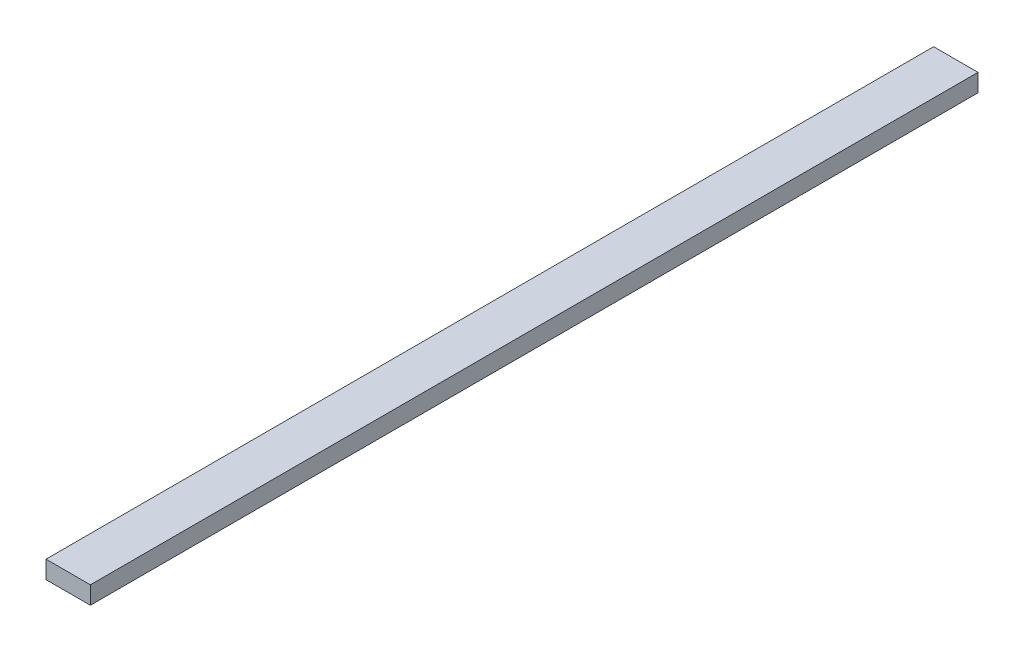
from build123d import *

# Parameters (mm, degrees)
CROQUIS1_R                   = 2.5
SALIENTE_EXTRUIR1_DEPTH      = 1.25
SALIENTE_EXTRUIR4_DEPTH      = 2.5
CROQUIS6_R                   = 12.525
CORTAR_EXTRUIR3_DEPTH        = 10
SALIENTE_EXTRUIR5_DEPTH      = 200
CROQUIS8_R                   = 12.525
SALIENTE_EXTRUIR6_DEPTH      = 21
CROQUIS10_W                  = 18.5
CROQUIS10_H                  = 25.138120499
CROQUIS10_W_2                = 2.5
CROQUIS10_H_2                = 4.861879501
CROQUIS10_H_3                = 5
CORTAR_EXTRUIR5_DEPTH        = 98
SALIENTE_EXTRUIR7_DEPTH      = 50
SALIENTE_EXTRUIR8_DEPTH      = 15
SALIENTE_EXTRUIR8_DEPTH_BACK = 265
CROQUIS15_W                  = 250
CROQUIS15_H                  = 5
CROQUIS15_W_2                = 280
SALIENTE_EXTRUIR9_DEPTH      = 7.5
CROQUIS16_W                  = 280
CROQUIS16_H                  = 5
CROQUIS16_W_2                = 250
CROQUIS16_H_2                = 30.3
CORTAR_EXTRUIR6_DEPTH        = 86


with BuildPart() as part:
    # Croquis1 → Saliente-Extruir1 (new, symmetric)
    with BuildSketch(Plane(origin=(0, 0, 0), x_dir=(0, 0, -1), z_dir=(1, 0, 0))):
        with BuildLine():
            Line((125, -2.5), (-125, -2.5))
            Line((-125, -2.5), (-125, 2.5))
            Line((-125, 2.5), (-123, 2.5))
            Line((-123, 2.5), (-117, 17.5))
            ThreePointArc((-117, 17.5), (-110, 24.5), (-103, 17.5))
            Line((-103, 17.5), (-97, 2.5))
            Line((-97, 2.5), (125, 2.5))
            Line((125, 2.5), (125, -2.5))
        make_face()
        with Locations((-110, 17.5)):
            Circle(CROQUIS1_R, mode=Mode.SUBTRACT)
    extrude(amount=SALIENTE_EXTRUIR1_DEPTH, both=True)

    # Croquis5 → Saliente-Extruir4 (add, through all)
    with BuildSketch(Plane(origin=(1.25, 0, 0), x_dir=(0, 0, -1), z_dir=(1, 0, 0))):
        with BuildLine():
            ThreePointArc((-100, 10), (-110, 5), (-120, 10))
            Line((-120, 10), (-121.0552482, 7.361879501))
            ThreePointArc((-121.0552482, 7.361879501), (-110, 2.5), (-98.9447518, 7.361879501))
            Line((-98.9447518, 7.361879501), (-100, 10))
        make_face()
        with BuildLine():
            Line((-121.0552482, 7.361879501), (-120, 10))
            ThreePointArc((-120, 10), (-113.952847075, 29.358541226), (-97.5, 17.5))
            ThreePointArc((-97.5, 17.5), (-98.141458774, 13.547152925), (-100, 10))
            Line((-100, 10), (-98.9447518, 7.361879501))
            ThreePointArc((-98.9447518, 7.361879501), (-96.020931308, 12.060731804), (-95, 17.5))
            ThreePointArc((-95, 17.5), (-115.439268196, 31.479068692), (-121.0552482, 7.361879501))
        make_face()
    extrude(amount=-SALIENTE_EXTRUIR4_DEPTH)

    # Croquis6 → Cortar-Extruir3 (cut)
    with BuildSketch(Plane(origin=(1.25, 0, 0), x_dir=(0, 0, -1), z_dir=(1, 0, 0))):
        with Locations((-110, 17.5)):
            Circle(CROQUIS6_R)
    extrude(amount=-CORTAR_EXTRUIR3_DEPTH, mode=Mode.SUBTRACT)

    # Croquis7 → Saliente-Extruir5 (add)
    with BuildSketch(Plane(origin=(0, 0, -125), x_dir=(-1, 0, 0), z_dir=(0, 0, -1))):
        Polygon((3.75, 37.8), (3.75, -2.5), (1.25, -2.5), (1.25, 2.5), (1.25, 32.8), (-1.25, 32.8), (-1.25, 37.8), align=None)
    extrude(amount=-SALIENTE_EXTRUIR5_DEPTH)

    # Croquis8 → Saliente-Extruir6 (add)
    with BuildSketch(Plane.ZY.offset(1.25)):
        with BuildLine():
            Line((98.9447518, 7.361879501), (97, 2.5))
            Line((97, 2.5), (95, 2.5))
            Line((95, 2.5), (95, -2.5))
            Line((95, -2.5), (125, -2.5))
            Line((125, -2.5), (125, 2.5))
            Line((125, 2.5), (123, 2.5))
            Line((123, 2.5), (121.0552482, 7.361879501))
            ThreePointArc((121.0552482, 7.361879501), (110, 32.5), (98.9447518, 7.361879501))
        make_face()
        with Locations(Location((110, 17.5, 0), (0, 0, 180))):
            Circle(CROQUIS8_R, mode=Mode.SUBTRACT)
    extrude(amount=SALIENTE_EXTRUIR6_DEPTH)

    # Croquis10 → Cortar-Extruir5 (cut)
    with BuildSketch(Plane.XY.offset(75)):
        with Locations((-13, 19.930939751)):
            Rectangle(CROQUIS10_W, CROQUIS10_H)
        Polygon((1.25, 37.8), (-3.75, 37.8), (-3.75, 32.5), (-1.25, 32.5), (-1.25, 32.8), (1.25, 32.8), align=None)
        with Locations((0, 19.930939751)):
            Rectangle(CROQUIS10_W_2, CROQUIS10_H)
        with Locations((-2.5, 19.930939751)):
            Rectangle(CROQUIS10_W_2, CROQUIS10_H)
        with Locations((-13, 4.930939751)):
            Rectangle(CROQUIS10_W, CROQUIS10_H_2)
        with Locations((-2.5, 4.930939751)):
            Rectangle(CROQUIS10_W_2, CROQUIS10_H_2)
        with Locations((0, 4.930939751)):
            Rectangle(CROQUIS10_W_2, CROQUIS10_H_2)
        with Locations((-2.5, 0)):
            Rectangle(CROQUIS10_W_2, CROQUIS10_H_3)
        with Locations((-13, 0)):
            Rectangle(CROQUIS10_W, CROQUIS10_H_3)
        Rectangle(CROQUIS10_W_2, CROQUIS10_H_3)
    extrude(amount=CORTAR_EXTRUIR5_DEPTH, mode=Mode.SUBTRACT)

    # Croquis11 → Saliente-Extruir7 (add)
    with BuildSketch(Plane.XY.offset(75)):
        Polygon((-3.75, 37.8), (-3.75, -2.5), (1.25, -2.5), (1.25, 2.5), (-1.25, 2.5), (-1.25, 32.8), (1.25, 32.8), (1.25, 37.8), align=None)
    extrude(amount=SALIENTE_EXTRUIR7_DEPTH)

    # Croquis14 → Saliente-Extruir8 (add, two sides: drawn at the far end of the back side and taken through both)
    with BuildSketch(Plane.XY.offset(125).offset(-SALIENTE_EXTRUIR8_DEPTH_BACK)):
        Polygon((-1.25, 32.8), (1.25, 32.8), (1.25, 37.8), (-3.75, 37.8), (-3.75, 32.8), align=None)
    extrude(amount=SALIENTE_EXTRUIR8_DEPTH + SALIENTE_EXTRUIR8_DEPTH_BACK)

    # Croquis15 → Saliente-Extruir9 (add)
    with BuildSketch(Plane(origin=(1.25, 0, 0), x_dir=(0, 0, -1), z_dir=(1, 0, 0))):
        Rectangle(CROQUIS15_W, CROQUIS15_H)
        with Locations((0, 35.3)):
            Rectangle(CROQUIS15_W_2, CROQUIS15_H)
    extrude(amount=SALIENTE_EXTRUIR9_DEPTH)

    # Croquis16 → Cortar-Extruir6 (cut)
    with BuildSketch(Plane(origin=(-1.25, 0, 0), x_dir=(0, 0, -1), z_dir=(1, 0, 0))):
        with Locations((0, 35.3)):
            Rectangle(CROQUIS16_W, CROQUIS16_H)
        with Locations((0, 17.65)):
            Rectangle(CROQUIS16_W_2, CROQUIS16_H_2)
    extrude(amount=-CORTAR_EXTRUIR6_DEPTH, mode=Mode.SUBTRACT)


with BuildPart() as cortar_extruir6_piece_1:
    # of the separate pieces the step leaves, piece 1, a body of its own (cortar_extruir6_pieces)
    add(part.part.solids().sort_by_distance((-3.75, -2.5, -125))[0])


with BuildPart() as cortar_extruir6_piece_2:
    # of the separate pieces the step leaves, piece 2, a body of its own (cortar_extruir6_pieces)
    add(part.part.solids().sort_by_distance((-1.25, 32.8, -140))[0])


solid = cortar_extruir6_piece_1.part
